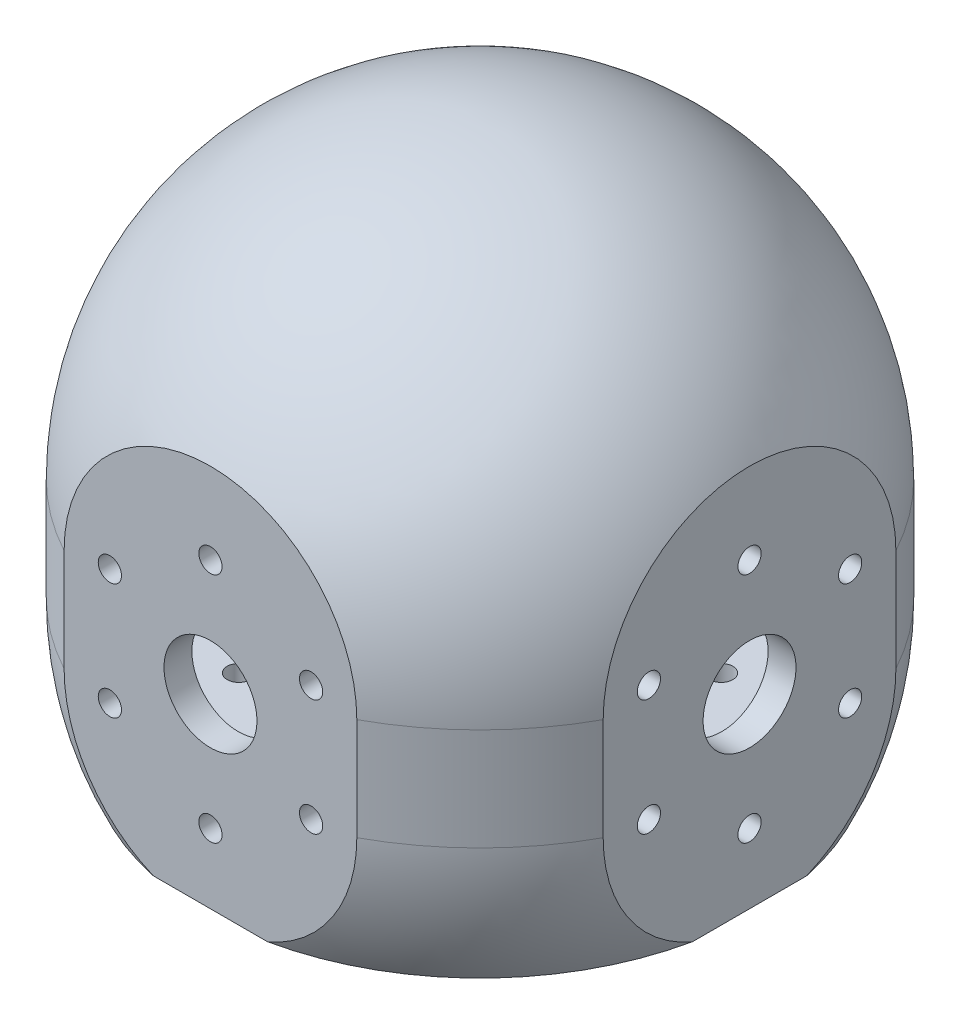
from build123d import *

# Parameters (mm, degrees)
CUT_EXTRUDE2_START  = 500
SKETCH3_R           = 96.25
CUT_EXTRUDE2_DEPTH  = 427.5
CIRPATTERN4_COUNT   = 4
SHELL2_T            = -7.5
SKETCH3_3_R         = 12.5
SKETCH3_3_R_2       = 3.125
CUT_EXTRUDE3_DEPTH  = 141.629166605
CIRPATTERN5_COUNT   = 4
BOSS_EXTRUDE1_START = -50
SKETCH5_R           = 40
SKETCH5_R_2         = 3.125
BOSS_EXTRUDE1_DEPTH = 10


with BuildPart() as part:
    # Main Revolve Sketch → Main Revolve (revolve)
    with BuildSketch(Plane.XY, mode=Mode.PRIVATE) as main_revolve_sk:
        with BuildLine():
            Line((0, 0), (0, 96.25))
            ThreePointArc((0, 96.25), (-58.336309448, 72.086309448), (-82.5, 13.75))
            Line((-82.5, 13.75), (-82.5, 0))
            Line((-82.5, 0), (-82.5, -13.75))
            ThreePointArc((-82.5, -13.75), (-80.374954989, -32.354209486), (-74.109294289, -50))
            Line((-74.109294289, -50), (0, -50))
            Line((0, -50), (0, 0))
        make_face()
    revolve(main_revolve_sk.sketch.rotate(Axis((0, 0, 0), (0, 1, 0)), 270), axis=Axis((0, 0, 0), (0, 1, 0)))

    # Sketch3 → Cut-Extrude2 (cut)
    with BuildSketch(Plane.XY.offset(CUT_EXTRUDE2_START)):
        Circle(SKETCH3_R)
    cut_extrude2 = extrude(amount=-CUT_EXTRUDE2_DEPTH, mode=Mode.SUBTRACT)

    # CirPattern4: Cut-Extrude2 ×4 about axis
    cirpattern4_axis = Axis((0, 0, 0), (0, 1, 0))
    for i in range(1, CIRPATTERN4_COUNT):
        add(cut_extrude2.rotate(cirpattern4_axis, i * 360 / CIRPATTERN4_COUNT), mode=Mode.SUBTRACT)

    # Shell2
    shell2_openings = [part.faces().sort_by_distance(p)[0] for p in [
        (0, -50, 0),
    ]]
    offset(amount=SHELL2_T, openings=shell2_openings)

    # Sketch3<3> → Cut-Extrude3 (cut, through all)
    with BuildSketch(Plane.XY):
        Circle(SKETCH3_3_R)
        with Locations((0, 31.25)):
            Circle(SKETCH3_3_R_2)
        with Locations((27.063293868, 15.625)):
            Circle(SKETCH3_3_R_2)
        with Locations((27.063293868, -15.625)):
            Circle(SKETCH3_3_R_2)
        with Locations((0, -31.25)):
            Circle(SKETCH3_3_R_2)
        with Locations((-27.063293868, -15.625)):
            Circle(SKETCH3_3_R_2)
        with Locations((-27.063293868, 15.625)):
            Circle(SKETCH3_3_R_2)
    cut_extrude3 = extrude(amount=-CUT_EXTRUDE3_DEPTH, mode=Mode.SUBTRACT)

    # CirPattern5: Cut-Extrude3 ×4 about axis
    cirpattern5_axis = Axis((0, 0, 0), (0, -1, 0))
    for i in range(1, CIRPATTERN5_COUNT):
        add(cut_extrude3.rotate(cirpattern5_axis, i * 360 / CIRPATTERN5_COUNT), mode=Mode.SUBTRACT)

    # Sketch5 → Boss-Extrude1 (add)
    with BuildSketch(Plane(origin=(0, 0, 0), x_dir=(1, 0, 0), z_dir=(0, 1, 0)).offset(BOSS_EXTRUDE1_START)):
        with BuildLine():
            Line((-72.5, 15.360257159), (-72.5, -15.360257159))
            ThreePointArc((-72.5, -15.360257159), (-52.403184541, -52.403184541), (-15.360257159, -72.5))
            Line((-15.360257159, -72.5), (15.360257159, -72.5))
            ThreePointArc((15.360257159, -72.5), (52.403184541, -52.403184541), (72.5, -15.360257159))
            Line((72.5, -15.360257159), (72.5, 15.360257159))
            ThreePointArc((72.5, 15.360257159), (52.403184541, 52.403184541), (15.360257159, 72.5))
            Line((15.360257159, 72.5), (-15.360257159, 72.5))
            ThreePointArc((-15.360257159, 72.5), (-52.403184541, 52.403184541), (-72.5, 15.360257159))
        make_face()
        with Locations(Location((0, 0, 0), (0, 0, 270))):
            Circle(SKETCH5_R, mode=Mode.SUBTRACT)
        with Locations(Location((0, -47.5, 0), (0, 0, 270))):
            Circle(SKETCH5_R_2, mode=Mode.SUBTRACT)
        with Locations(Location((47.5, 0, 0), (0, 0, 270))):
            Circle(SKETCH5_R_2, mode=Mode.SUBTRACT)
        with Locations(Location((41.13620668, 23.75, 0), (0, 0, 270))):
            Circle(SKETCH5_R_2, mode=Mode.SUBTRACT)
        with Locations(Location((23.75, 41.13620668, 0), (0, 0, 270))):
            Circle(SKETCH5_R_2, mode=Mode.SUBTRACT)
        with Locations(Location((0, 47.5, 0), (0, 0, 270))):
            Circle(SKETCH5_R_2, mode=Mode.SUBTRACT)
        with Locations(Location((-23.75, 41.13620668, 0), (0, 0, 270))):
            Circle(SKETCH5_R_2, mode=Mode.SUBTRACT)
        with Locations(Location((-41.13620668, 23.75, 0), (0, 0, 270))):
            Circle(SKETCH5_R_2, mode=Mode.SUBTRACT)
        with Locations(Location((-47.5, 0, 0), (0, 0, 270))):
            Circle(SKETCH5_R_2, mode=Mode.SUBTRACT)
        with Locations(Location((-41.13620668, -23.75, 0), (0, 0, 270))):
            Circle(SKETCH5_R_2, mode=Mode.SUBTRACT)
        with Locations(Location((41.13620668, -23.75, 0), (0, 0, 270))):
            Circle(SKETCH5_R_2, mode=Mode.SUBTRACT)
        with Locations(Location((-23.75, -41.13620668, 0), (0, 0, 270))):
            Circle(SKETCH5_R_2, mode=Mode.SUBTRACT)
        with Locations(Location((23.75, -41.13620668, 0), (0, 0, 270))):
            Circle(SKETCH5_R_2, mode=Mode.SUBTRACT)
    extrude(amount=BOSS_EXTRUDE1_DEPTH)


solid = part.part
